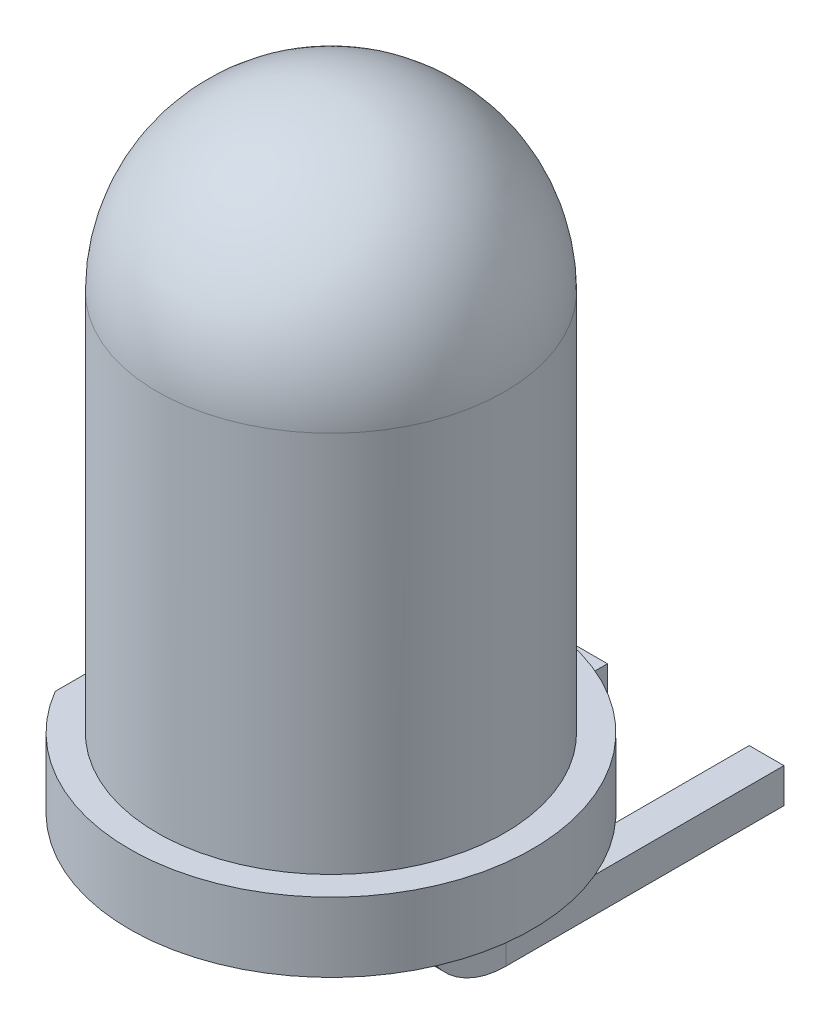
from build123d import *

# Parameters (mm, degrees)
SKETCH2_W          = 0.4
SKETCH2_H          = 2.939387692
CUT_EXTRUDE1_DEPTH = 10.890399385
SKETCH3_W          = 0.5
SKETCH3_H          = 0.5


with BuildPart() as part:
    # Sketch1 → Revolve1 (revolve)
    with BuildSketch(Plane(origin=(0, 0, 0), x_dir=(1, 0, 0), z_dir=(0, 0, -1)), mode=Mode.PRIVATE) as revolve1_sk:
        with BuildLine():
            Line((0, 0), (0, -9))
            ThreePointArc((0, -9), (1.767766953, -8.267766953), (2.5, -6.5))
            Line((2.5, -6.5), (2.5, -1))
            Line((2.5, -1), (2.9, -1))
            Line((2.9, -1), (2.9, 0))
            Line((2.9, 0), (0, 0))
        make_face()
    revolve(revolve1_sk.sketch.rotate(Axis((0, 0, 0), (0, 1, 0)), 90), axis=Axis((0, 0, 0), (0, 1, 0)))

    # Sketch2 → Cut-Extrude1 (cut, through all)
    with BuildSketch(Plane(origin=(0, 0, 0), x_dir=(-1, 0, 0), z_dir=(0, -1, 0))):
        with Locations((2.7, 0)):
            Rectangle(SKETCH2_W, SKETCH2_H)
    extrude(amount=-CUT_EXTRUDE1_DEPTH, mode=Mode.SUBTRACT)

    # Sweep1: sweep along a path in Sketch4
    with BuildLine(Plane(origin=(-1.27, 0, 0), x_dir=(0, 0, -1), z_dir=(1, 0, 0))) as sweep1_path:
        Line((0, 0), (0, -0.4))
        ThreePointArc((0, -0.4), (0.292893219, -1.107106781), (1, -1.4))
        Line((1, -1.4), (5, -1.4))
    # Sketch3 → Sweep1 (sweep)
    with BuildSketch(Plane(origin=(0, 0, 0), x_dir=(-1, 0, 0), z_dir=(0, -1, 0))):
        with Locations((-1.27, 0)):
            Rectangle(SKETCH3_W, SKETCH3_H)
        with Locations((1.27, 0)):
            Rectangle(SKETCH3_W, SKETCH3_H)
    sweep(path=sweep1_path.line)


solid = part.part
